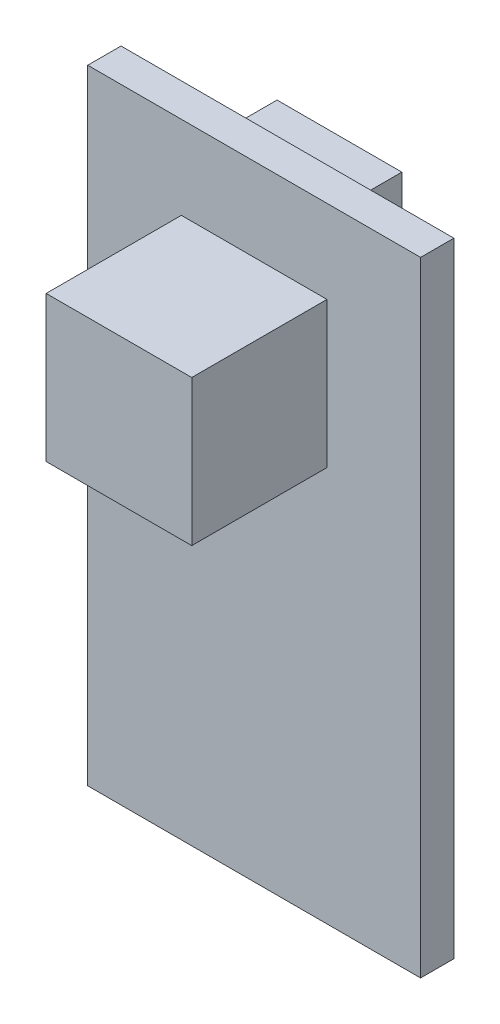
from build123d import *

# Parameters (mm, degrees)
SKETCH1_W           = 16
SKETCH1_H           = 30
BOSS_EXTRUDE1_DEPTH = 1.6
SKETCH2_W           = 6
SKETCH2_H           = 28
BOSS_EXTRUDE2_DEPTH = 2.5
SKETCH3_W           = 7
SKETCH3_H           = 7
BOSS_EXTRUDE3_DEPTH = 6.5


with BuildPart() as part:
    # Sketch1 → Boss-Extrude1 (new body)
    with BuildSketch(Plane.XY.offset(13.1)):
        with Locations((22, 3)):
            Rectangle(SKETCH1_W, SKETCH1_H)
    extrude(amount=BOSS_EXTRUDE1_DEPTH)

    # Sketch2 → Boss-Extrude2 (add)
    with BuildSketch(Plane.XY.offset(10.6)):
        with Locations((22, 3)):
            Rectangle(SKETCH2_W, SKETCH2_H)
    extrude(amount=BOSS_EXTRUDE2_DEPTH)

    # Sketch3 → Boss-Extrude3 (add)
    with BuildSketch(Plane.XY.offset(14.7)):
        with Locations((22, 10.5)):
            Rectangle(SKETCH3_W, SKETCH3_H)
    extrude(amount=BOSS_EXTRUDE3_DEPTH)


solid = part.part
